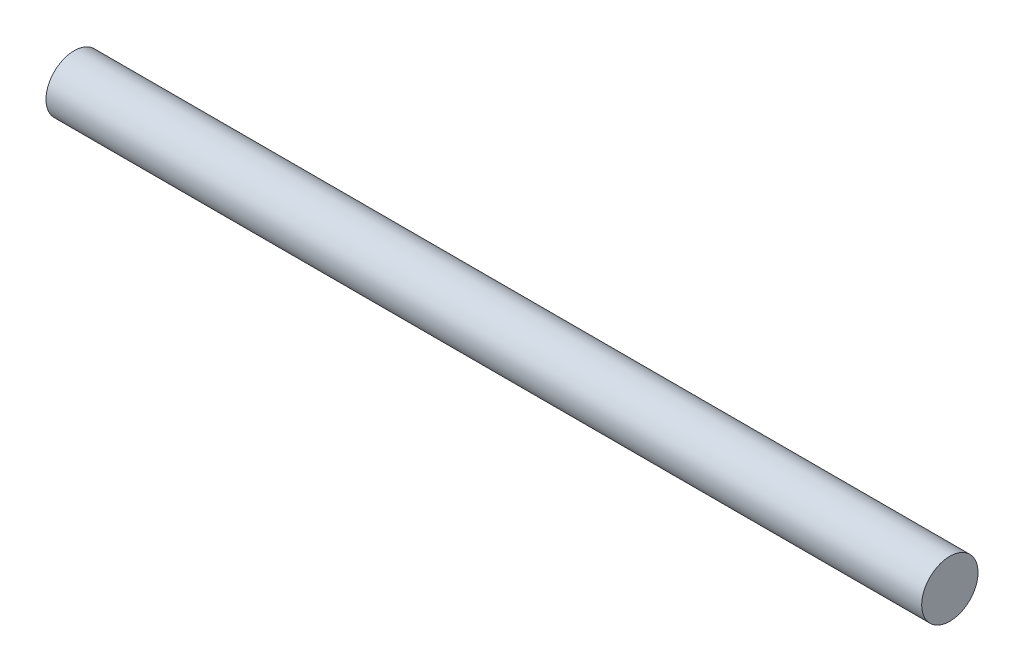
from build123d import *

# Parameters (mm, degrees)
SKETCH_1_W = 264
SKETCH_1_H = 8.5


with BuildPart() as part:
    # 草图1 → 旋转1 (revolve)
    with BuildSketch(Plane(origin=(0, 0, 0), x_dir=(1, 0, 0), z_dir=(0, 1, 0))):
        with Locations((132, -4.25)):
            Rectangle(SKETCH_1_W, SKETCH_1_H)
    revolve(axis=Axis((-70.491768368, 0, 0), (1, 0, 0)))


solid = part.part
